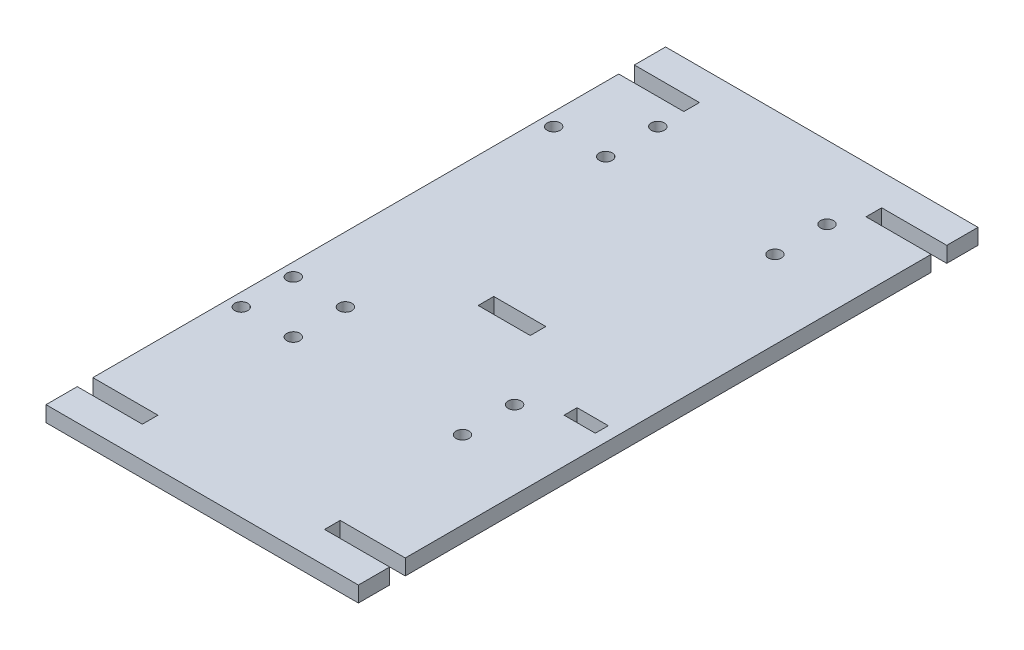
from build123d import *

# Parameters (mm, degrees)
SKETCH1_W            = 120
SKETCH1_H            = 238
BOSS_EXTRUDE1_DEPTH  = 6
SKETCH2_W            = 25
SKETCH2_H            = 6
CUT_EXTRUDE1_DEPTH   = 267.608326952
LPATTERN1_COUNT      = 2
LPATTERN1_PITCH      = 208
LPATTERN1_COUNT_DIR2 = 2
LPATTERN1_PITCH_DIR2 = 95
SKETCH3_W            = 20
SKETCH3_H            = 6
CUT_EXTRUDE2_DEPTH   = 10
SKETCH4_R            = 2.5
CUT_EXTRUDE4_DEPTH   = 10
SKETCH6_W            = 12
SKETCH6_H            = 5
CUT_EXTRUDE5_DEPTH   = 10


with BuildPart() as part:
    # Sketch1 → Boss-Extrude1 (new body)
    with BuildSketch(Plane(origin=(0, 0, 0), x_dir=(1, 0, 0), z_dir=(0, 1, 0))):
        with Locations((-60, 119)):
            Rectangle(SKETCH1_W, SKETCH1_H)
    extrude(amount=BOSS_EXTRUDE1_DEPTH)

    # Sketch2 → Cut-Extrude1 (cut, through all)
    with BuildSketch(Plane(origin=(0, 6, 0), x_dir=(1, 0, 0), z_dir=(0, 1, 0))):
        with Locations((-107.5, 223)):
            Rectangle(SKETCH2_W, SKETCH2_H)
    cut_extrude1 = extrude(amount=-CUT_EXTRUDE1_DEPTH, mode=Mode.SUBTRACT)

    # LPattern1: Cut-Extrude1 2 × 2
    with Locations(*[(j * LPATTERN1_PITCH_DIR2, 0, i * LPATTERN1_PITCH) for i in range(LPATTERN1_COUNT) for j in range(LPATTERN1_COUNT_DIR2) if (i, j) != (0, 0)]):
        add(cut_extrude1, mode=Mode.SUBTRACT)

    # Sketch3 → Cut-Extrude2 (cut)
    with BuildSketch(Plane(origin=(0, 6, 0), x_dir=(1, 0, 0), z_dir=(0, 1, 0))):
        with Locations((-60, 119)):
            Rectangle(SKETCH3_W, SKETCH3_H)
    extrude(amount=-CUT_EXTRUDE2_DEPTH, mode=Mode.SUBTRACT)

    # Sketch4 → Cut-Extrude4 (cut)
    with BuildSketch(Plane(origin=(0, 6, 0), x_dir=(1, 0, 0), z_dir=(0, 1, 0))):
        with Locations(Location((-30, 210, 0), (0, 0, 270))):
            Circle(SKETCH4_R)
        with Locations(Location((-30, 190, 0), (0, 0, 270))):
            Circle(SKETCH4_R)
        with Locations(Location((-95, 210, 0), (0, 0, 270))):
            Circle(SKETCH4_R)
        with Locations(Location((-95, 190, 0), (0, 0, 270))):
            Circle(SKETCH4_R)
        with Locations(Location((-115, 190, 0), (0, 0, 270))):
            Circle(SKETCH4_R)
        with Locations(Location((-95, 90, 0), (0, 0, 270))):
            Circle(SKETCH4_R)
        with Locations(Location((-115, 90, 0), (0, 0, 270))):
            Circle(SKETCH4_R)
        with Locations(Location((-95, 70, 0), (0, 0, 270))):
            Circle(SKETCH4_R)
        with Locations(Location((-30, 90, 0), (0, 0, 270))):
            Circle(SKETCH4_R)
        with Locations(Location((-30, 70, 0), (0, 0, 270))):
            Circle(SKETCH4_R)
        with Locations(Location((-115, 70, 0), (0, 0, 270))):
            Circle(SKETCH4_R)
    extrude(amount=-CUT_EXTRUDE4_DEPTH, mode=Mode.SUBTRACT)

    # Sketch6 → Cut-Extrude5 (cut)
    with BuildSketch(Plane(origin=(0, 6, 0), x_dir=(1, 0, 0), z_dir=(0, 1, 0))):
        with Locations((-11, 98.5)):
            Rectangle(SKETCH6_W, SKETCH6_H)
    extrude(amount=-CUT_EXTRUDE5_DEPTH, mode=Mode.SUBTRACT)


solid = part.part
